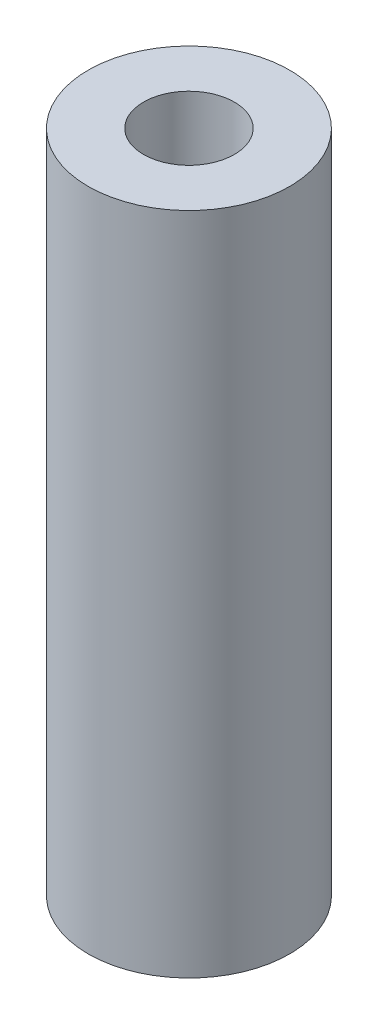
from build123d import *

# Parameters (mm, degrees)
SKETCH1_R                 = 3
BOSS_EXTRUDE1_DEPTH       = 19.79
F_6_32_TAPPED_HOLE1_D     = 2.7051
F_6_32_TAPPED_HOLE1_DEPTH = 7
F_6_32_TAPPED_HOLE1_TIP   = 0.81269403
F_6_32_TAPPED_HOLE2_D     = 2.7051
F_6_32_TAPPED_HOLE2_DEPTH = 7
F_6_32_TAPPED_HOLE2_TIP   = 0.81269403


with BuildPart() as part:
    # Sketch1 → Boss-Extrude1 (new body)
    with BuildSketch(Plane(origin=(0, 0, 0), x_dir=(1, 0, 0), z_dir=(0, 1, 0))):
        with Locations(Location((0, 0, 0), (0, 0, 270))):
            Circle(SKETCH1_R)
    extrude(amount=BOSS_EXTRUDE1_DEPTH)

    # #6-32 Tapped Hole1
    with Locations(Plane(origin=(0, 19.79, 0), x_dir=(1, 0, 0), z_dir=(0, 1, 0))):
        with Locations((0, 0)):
            Hole(F_6_32_TAPPED_HOLE1_D / 2, depth=F_6_32_TAPPED_HOLE1_DEPTH)
            with Locations((0, 0, -(F_6_32_TAPPED_HOLE1_DEPTH + F_6_32_TAPPED_HOLE1_TIP / 2))):  # 118° drill point
                Cone(0, F_6_32_TAPPED_HOLE1_D / 2, F_6_32_TAPPED_HOLE1_TIP, mode=Mode.SUBTRACT)

    # #6-32 Tapped Hole2
    with Locations(Plane(origin=(0, 0, 0), x_dir=(-1, 0, 0), z_dir=(0, -1, 0))):
        with Locations((0, 0)):
            Hole(F_6_32_TAPPED_HOLE2_D / 2, depth=F_6_32_TAPPED_HOLE2_DEPTH)
            with Locations((0, 0, -(F_6_32_TAPPED_HOLE2_DEPTH + F_6_32_TAPPED_HOLE2_TIP / 2))):  # 118° drill point
                Cone(0, F_6_32_TAPPED_HOLE2_D / 2, F_6_32_TAPPED_HOLE2_TIP, mode=Mode.SUBTRACT)


solid = part.part
